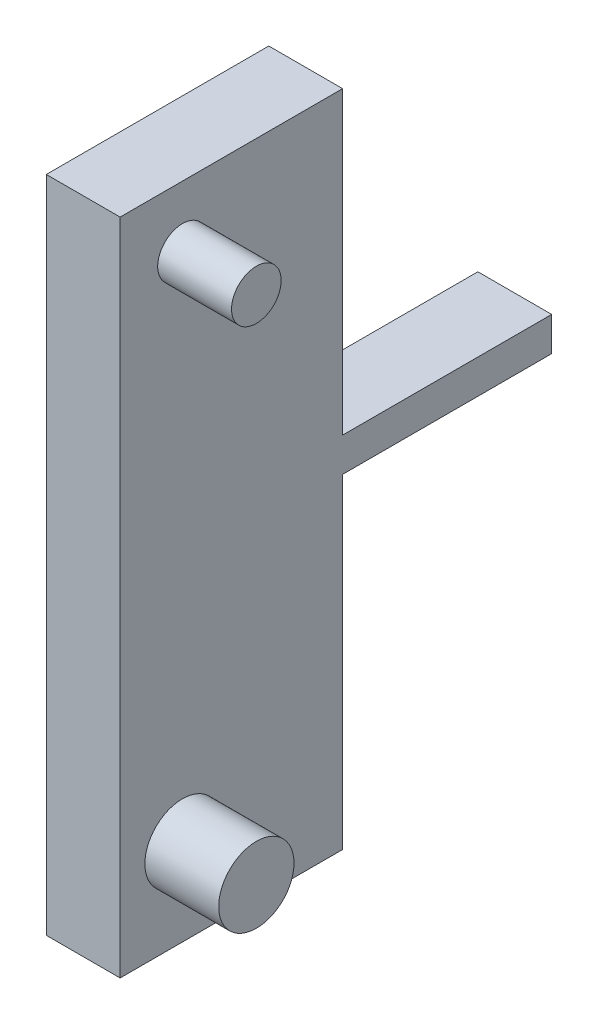
from build123d import *

# Parameters (mm, degrees)
SKETCH1_R             = 2.55
BOSS_EXTRUDE1_DEPTH   = 10
SKETCH1_R_2           = 1.68
BOSS_EXTRUDE1_2_DEPTH = 10
SKETCH2_W             = 2.303802682
SKETCH2_H             = 14.158597278
SKETCH2_H_2           = 10.841402722
BOSS_EXTRUDE2_DEPTH   = 5


with BuildPart() as part:
    # Sketch1 → Boss-Extrude1 (new body)
    with BuildSketch(Plane.YZ):
        with Locations(Location((-75.554303292, 44.238232385, 0), (0, 0, 270))):
            Circle(SKETCH1_R)
    extrude(amount=BOSS_EXTRUDE1_DEPTH)



with BuildPart() as body_2:
    # Sketch1 → Boss-Extrude1 2 (new body)
    with BuildSketch(Plane.YZ):
        with Locations(Location((-40.954303292, 44.238232385, 0), (0, 0, 270))):
            Circle(SKETCH1_R_2)
    extrude(amount=BOSS_EXTRUDE1_2_DEPTH)


with BuildPart() as part_1:
    add(part.part)

    add(body_2.part)  # Boss-Extrude2 merges body 2
    # Sketch2 → Boss-Extrude2 (add)
    with BuildSketch(Plane.YZ):
        with Locations((-58.254303292, 26.317531024)):
            Rectangle(SKETCH2_W, SKETCH2_H)
        with Locations((-58.254303292, 38.817531024)):
            Rectangle(SKETCH2_W, SKETCH2_H_2)
        Polygon((-36.783173072, 48.461100861), (-81.407523603, 48.461100861), (-81.407523603, 33.396829663), (-59.406204633, 33.396829663), (-59.406204633, 44.238232385), (-57.102401951, 44.238232385), (-57.102401951, 33.396829663), (-36.783173072, 33.396829663), align=None)
    extrude(amount=BOSS_EXTRUDE2_DEPTH)


solid = part_1.part
